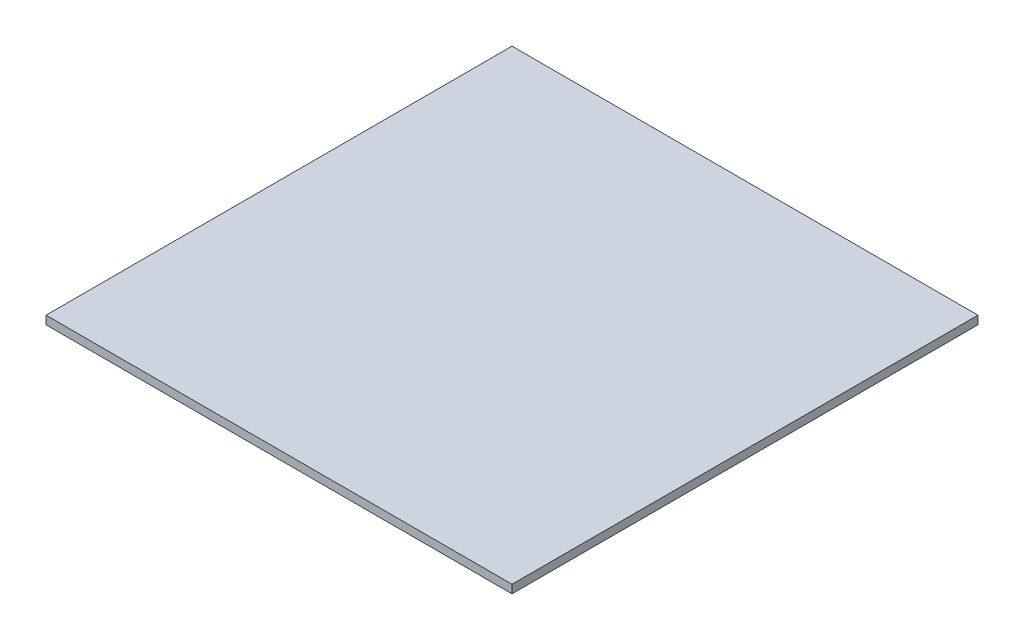
from build123d import *

# Parameters (mm, degrees)
SKETCH1_W           = 560
SKETCH1_H           = 560
BOSS_EXTRUDE1_DEPTH = 10


with BuildPart() as part:
    # Sketch1 → Boss-Extrude1 (new body)
    with BuildSketch(Plane(origin=(0, 0, 0), x_dir=(1, 0, 0), z_dir=(0, 1, 0))):
        Rectangle(SKETCH1_W, SKETCH1_H)
    extrude(amount=BOSS_EXTRUDE1_DEPTH)


solid = part.part
